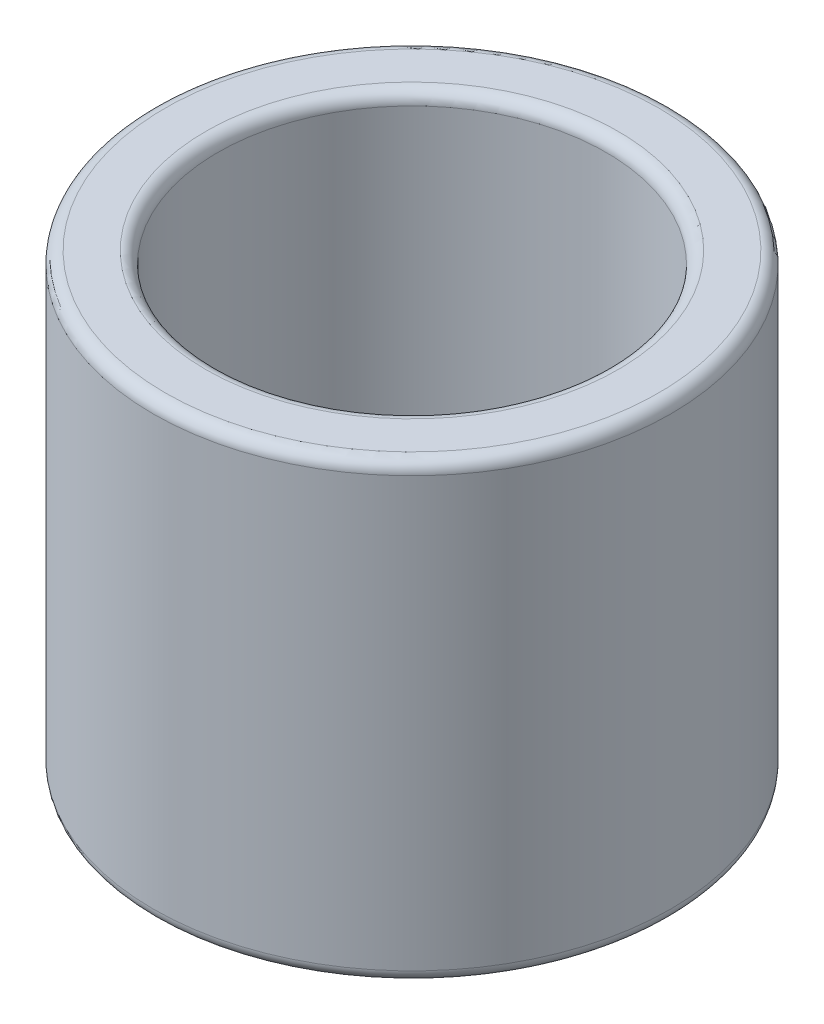
from build123d import *

# Parameters (mm, degrees)
SKETCH_1_R      = 16
SKETCH_1_R_2    = 12
EXTRUDE_1_DEPTH = 14
FILLET_1_R      = 0.75


with BuildPart() as part:
    # 草图1 → 凸台-拉伸1 (new, symmetric)
    with BuildSketch(Plane(origin=(0, 0, 0), x_dir=(1, 0, 0), z_dir=(0, 1, 0))):
        with Locations(Location((0, 0, 0), (0, 0, 270))):
            Circle(SKETCH_1_R)
        with Locations(Location((0, 0, 0), (0, 0, 270))):
            Circle(SKETCH_1_R_2, mode=Mode.SUBTRACT)
    extrude(amount=EXTRUDE_1_DEPTH, both=True)

    # 圆角1
    fillet_1_edges = [part.edges().sort_by_distance(p)[0] for p in [
        (0, -14, -16),
        (0, 14, -16),
        (0, -14, -12),
        (0, 14, -12),
    ]]
    fillet(fillet_1_edges, radius=FILLET_1_R)


solid = part.part
